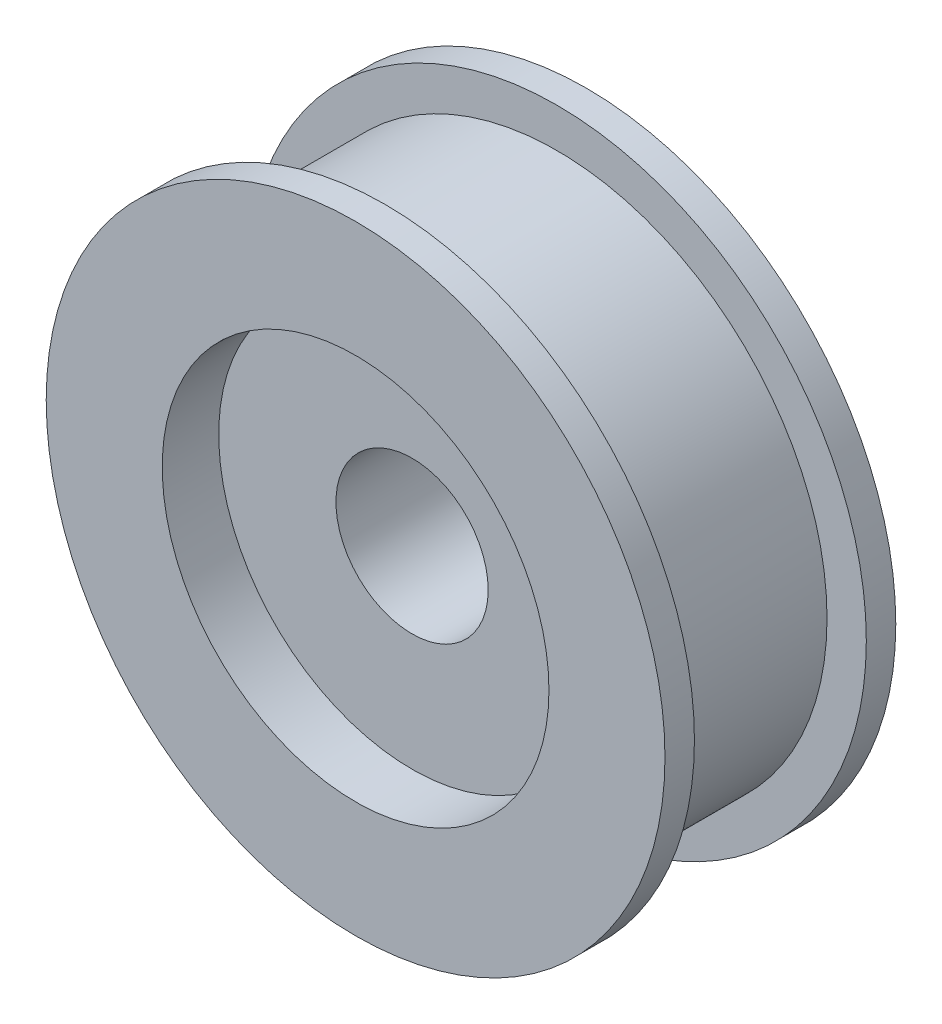
from build123d import *

# Parameters (mm, degrees)
ESQUISSE2_R             = 7.875
ESQUISSE2_R_2           = 3.1
BOSS_EXTRU_1_DEPTH      = 2.4
BOSS_EXTRU_2_DEPTH      = 2.3
BOSS_EXTRU_2_DEPTH_BACK = 7.1
ESQUISSE3_R             = 12.6
ESQUISSE3_R_2           = 7.875
ESQUISSE4_R             = 12.6
ESQUISSE4_R_2           = 11
ENL_V_MAT_EXTRU_1_DEPTH = 3.5


with BuildPart() as part:
    # Esquisse2 → Boss.-Extru.1 (new, symmetric)
    with BuildSketch(Plane.XY):
        Circle(ESQUISSE2_R)
        Circle(ESQUISSE2_R_2, mode=Mode.SUBTRACT)
    extrude(amount=BOSS_EXTRU_1_DEPTH, both=True)

    # Esquisse3 → Boss.-Extru.2 (add, two sides: drawn at the far end of the back side and taken through both)
    with BuildSketch(Plane.XY.offset(2.4).offset(-BOSS_EXTRU_2_DEPTH_BACK)):
        Circle(ESQUISSE3_R)
        Circle(ESQUISSE3_R_2, mode=Mode.SUBTRACT)
    extrude(amount=BOSS_EXTRU_2_DEPTH + BOSS_EXTRU_2_DEPTH_BACK)

    # Esquisse4 → Enlèv. mat.-Extru.1 (cut, symmetric)
    with BuildSketch(Plane.XY):
        Circle(ESQUISSE4_R)
        Circle(ESQUISSE4_R_2, mode=Mode.SUBTRACT)
    extrude(amount=ENL_V_MAT_EXTRU_1_DEPTH, both=True, mode=Mode.SUBTRACT)


solid = part.part
